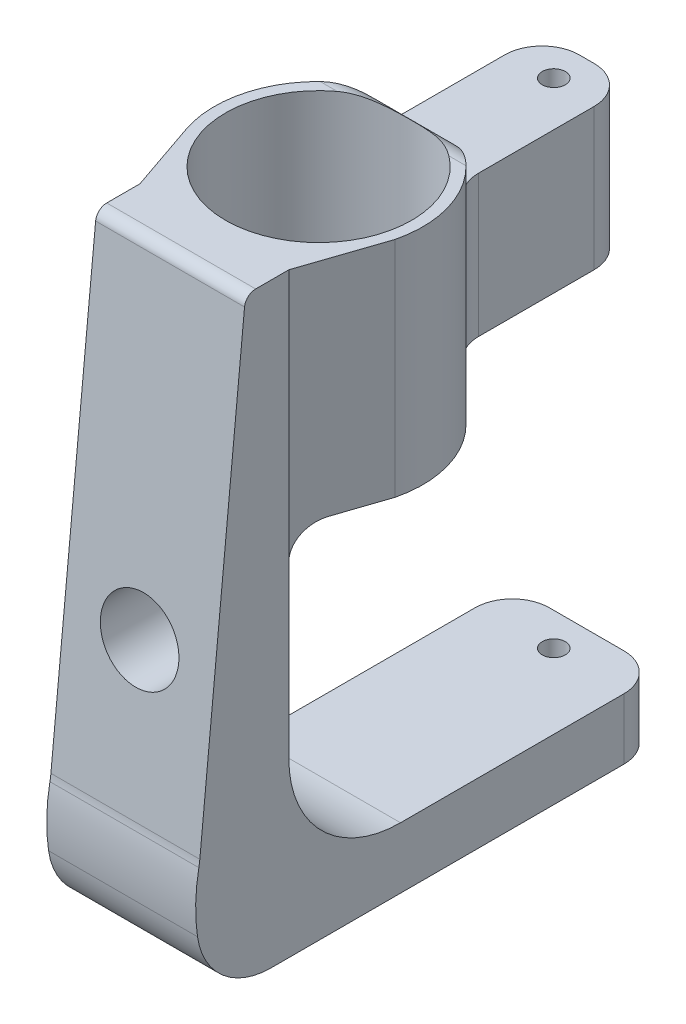
from build123d import *
from OCP.BRepFilletAPI import BRepFilletAPI_MakeFillet

# Parameters (mm, degrees)
SKETCH1_R               = 12.5
BOSS_EXTRUDE1_DEPTH     = 80
CUT_EXTRUDE1_DEPTH      = 88.77439656
CUT_EXTRUDE1_DEPTH_BACK = 88.77439656
SKETCH4_OUTSIDE_W       = 61.818
SKETCH4_OUTSIDE_H       = 100.83
SKETCH6_W               = 20
SKETCH6_H               = 8.19180338
SKETCH6_W_2             = 12
SKETCH6_H_2             = 19
BOSS_EXTRUDE3_DEPTH     = 50
CUT_EXTRUDE2_START      = -30
SKETCH8_R               = 12.5
CUT_EXTRUDE2_DEPTH      = 30
FILLET1_R               = 5
FILLET2_R               = 15
FILLET3_R1              = 1
FILLET3_R2              = 5
CUT_EXTRUDE4_DEPTH      = 84.91706908
CUT_EXTRUDE4_DEPTH_BACK = 84.91706908
SKETCH11_R              = 1.55
FILLET4_R               = 10
SKETCH12_R              = 5.25
CUT_EXTRUDE5_DEPTH      = 96.372952239


with BuildPart() as part:
    # Sketch1 → Boss-Extrude1 (new body)
    with BuildSketch(Plane(origin=(0, 0, 0), x_dir=(1, 0, 0), z_dir=(0, 1, 0))):
        with BuildLine():
            Line((-13.243243243, -4.540540541), (-10, -14))
            Line((-10, -14), (-10, -26.98786193))
            Line((-10, -26.98786193), (10, -26.98786193))
            Line((10, -26.98786193), (10, -14))
            Line((10, -14), (13.597983435, -3.330892747))
            ThreePointArc((13.597983435, -3.330892747), (-0.630295246, 13.985804514), (-13.243243243, -4.540540541))
        make_face()
        with Locations(Location((0, 0, 0), (0, 0, 270))):
            Circle(SKETCH1_R, mode=Mode.SUBTRACT)
    extrude(amount=BOSS_EXTRUDE1_DEPTH)

    # Sketch4 outside → Cut-Extrude1 (cut, two sides: drawn at the far end of the back side and taken through both)
    with BuildSketch(Plane.ZY.offset(10).offset(-CUT_EXTRUDE1_DEPTH_BACK)):
        with Locations((6.494, 40)):
            Rectangle(SKETCH4_OUTSIDE_W, SKETCH4_OUTSIDE_H)
        with BuildLine():
            Line((-10, 50), (10, 50))
            ThreePointArc((10, 50), (12.828427125, 48.828427125), (14, 46))
            Line((14, 46), (14, 0))
            Line((14, 0), (23.289589956, 0))
            ThreePointArc((23.289589956, 0), (26.209542913, 8.210116535), (25.999737715, 16.921495334))
            Line((25.999737715, 16.921495334), (19.944041303, 78.646458452))
            ThreePointArc((19.944041303, 78.646458452), (19.458758034, 79.611235276), (18.451208451, 80))
            Line((18.451208451, 80), (14, 80))
            Line((14, 80), (-10, 80))
            ThreePointArc((-10, 80), (-12.828427125, 78.828427125), (-14, 76))
            Line((-14, 76), (-14, 54))
            ThreePointArc((-14, 54), (-12.828427125, 51.171572875), (-10, 50))
        make_face(mode=Mode.SUBTRACT)
    extrude(amount=CUT_EXTRUDE1_DEPTH + CUT_EXTRUDE1_DEPTH_BACK, mode=Mode.SUBTRACT)

    # Sketch6 → Boss-Extrude3 (add)
    with BuildSketch(Plane(origin=(0, 0, 14), x_dir=(-1, 0, 0), z_dir=(0, 0, -1))):
        with Locations((0, 4.09590169)):
            Rectangle(SKETCH6_W, SKETCH6_H)
        with Locations((0, 64.998822006)):
            Rectangle(SKETCH6_W_2, SKETCH6_H_2)
    extrude(amount=BOSS_EXTRUDE3_DEPTH)

    # Sketch8 → Cut-Extrude2 (cut)
    with BuildSketch(Plane(origin=(0, 80, 0), x_dir=(1, 0, 0), z_dir=(0, 1, 0)).offset(CUT_EXTRUDE2_START)):
        with Locations(Location((0, 0, 0), (0, 0, 53.130102354))):
            Circle(SKETCH8_R)
    extrude(amount=CUT_EXTRUDE2_DEPTH, mode=Mode.SUBTRACT)

    # Fillet1
    fillet1_edges = [part.edges().sort_by_distance(p)[0] for p in [
        (10, 4.09590169, -36),
        (-10, 4.09590169, -36),
        (6, 64.998822006, -36),
        (-6, 64.998822006, -36),
    ]]
    fillet(fillet1_edges, radius=FILLET1_R)

    # Fillet2
    fillet2_edges = [part.edges().sort_by_distance(p)[0] for p in [
        (0, 8.19180338, 14),
    ]]
    fillet(fillet2_edges, radius=FILLET2_R)

    # Fillet3: one fillet with a radius per group of edges: ONE call of the kernel's fillet builder (fillet() takes one radius for all edges)
    fillet3_edges_1 = [part.edges().sort_by_distance(p)[0] for p in [
        (0, 74.498822006, -14),
        (0, 55.498822006, -14),
    ]]
    fillet3_edges_2 = [part.edges().sort_by_distance(p)[0] for p in [
        (-6, 64.998822006, -12.649110641),
        (6, 64.998822006, -12.649110641),
    ]]
    fillet3 = BRepFilletAPI_MakeFillet(part.part.solid().wrapped)
    for e in fillet3_edges_1:
        fillet3.Add(FILLET3_R1, e.wrapped)
    for e in fillet3_edges_2:
        fillet3.Add(FILLET3_R2, e.wrapped)
    add(Compound.cast(fillet3.Shape()), mode=Mode.REPLACE)

    # Sketch11 → Cut-Extrude4 (cut, two sides: drawn at the far end of the back side and taken through both)
    with BuildSketch(Plane(origin=(0, 74.498822006, 0), x_dir=(1, 0, 0), z_dir=(0, 1, 0)).offset(-CUT_EXTRUDE4_DEPTH_BACK)):
        with Locations(Location((0, 31.585251235, 0), (0, 0, 270))):
            Circle(SKETCH11_R)
    extrude(amount=CUT_EXTRUDE4_DEPTH + CUT_EXTRUDE4_DEPTH_BACK, mode=Mode.SUBTRACT)

    # Fillet4
    fillet4_edges = [part.edges().sort_by_distance(p)[0] for p in [
        (0, 16.921495334, 25.999737715),
        (0, 0, 23.289589956),
    ]]
    fillet(fillet4_edges, radius=FILLET4_R)

    # Sketch12 → Cut-Extrude5 (cut, through all)
    with BuildSketch(Plane(origin=(0, 0, 14), x_dir=(-1, 0, 0), z_dir=(0, 0, -1))):
        with Locations((0, 36.973808643)):
            Circle(SKETCH12_R)
    extrude(amount=-CUT_EXTRUDE5_DEPTH, mode=Mode.SUBTRACT)


solid = part.part
